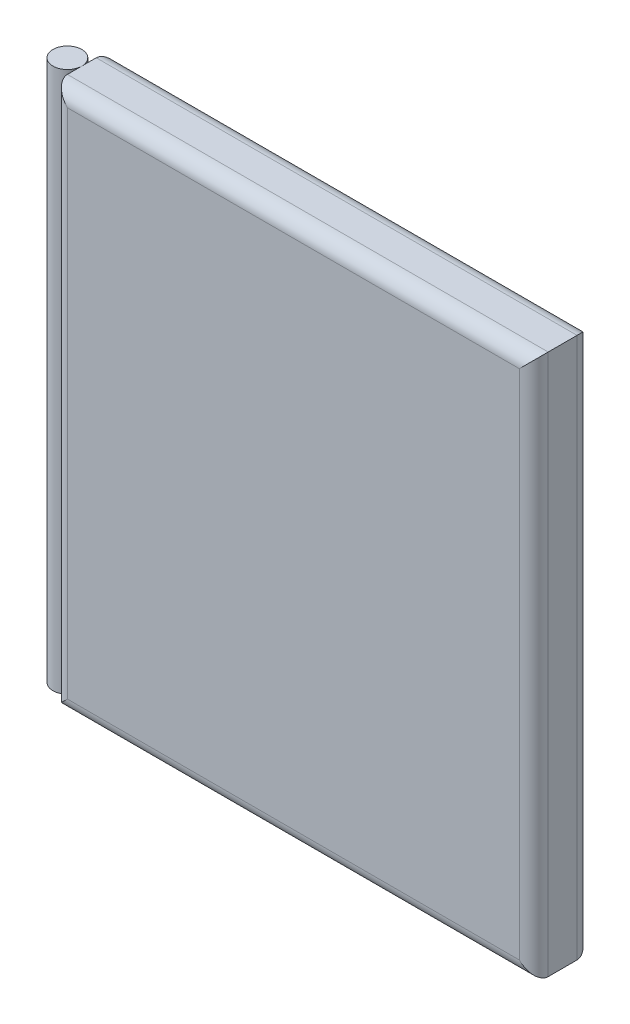
from build123d import *

# Parameters (mm, degrees)
SKETCH2_W           = 666.6
SKETCH2_H           = 750
BOSS_EXTRUDE1_DEPTH = 80
FILLET1_R           = 20
SKETCH3_R           = 20
BOSS_EXTRUDE2_DEPTH = 750


with BuildPart() as part:
    # Sketch2 → Boss-Extrude1 (new body)
    with BuildSketch(Plane.XY):
        with Locations((77.305323194, -243.834410646)):
            Rectangle(SKETCH2_W, SKETCH2_H)
    extrude(amount=BOSS_EXTRUDE1_DEPTH)

    # Fillet1
    fillet1_edges = [part.edges().sort_by_distance(p)[0] for p in [
        (410.605323194, -243.834410646, 80),
        (77.305323194, 131.165589354, 80),
        (-255.994676806, -243.834410646, 80),
        (77.305323194, 131.165589354, 0),
        (410.605323194, -243.834410646, 0),
        (77.305323194, -618.834410646, 0),
        (-255.994676806, -243.834410646, 0),
        (77.305323194, -618.834410646, 80),
    ]]
    fillet(fillet1_edges, radius=FILLET1_R)


with BuildPart() as body_2:
    # Sketch3 → Boss-Extrude2 (new body)
    with BuildSketch(Plane(origin=(0, -618.834410646, 0), x_dir=(-1, 0, 0), z_dir=(0, -1, 0))):
        with Locations(Location((275.994676806, -40, 0), (0, 0, 90))):
            Circle(SKETCH3_R)
    extrude(amount=-BOSS_EXTRUDE2_DEPTH)


solid = Compound([part.part, body_2.part])
